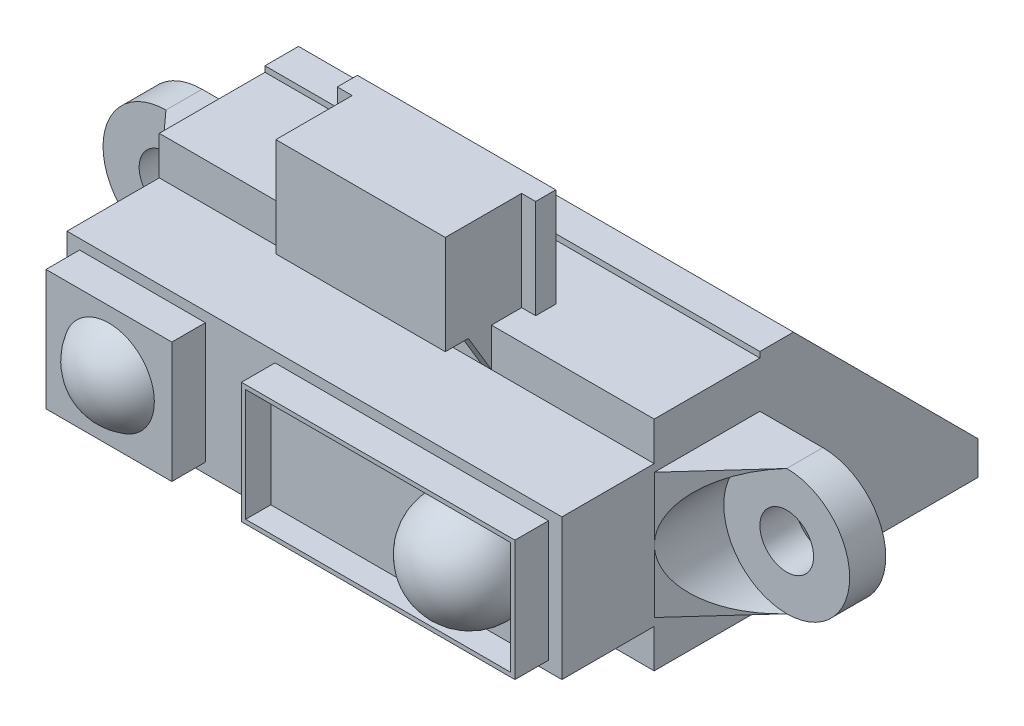
from build123d import *

# Parameters (mm, degrees)
BOSS_EXTRU_2_DEPTH      = 2.15
ESQUISSE2_W             = 14.75
ESQUISSE2_H             = 13
BOSS_EXTRU_3_DEPTH      = 6.3
BOSS_EXTRU_4_DEPTH      = 7.5
BOSS_EXTRUDE1_DEPTH     = 13
CHAMFER1_SIZE           = 11
ESQUISSE3_R             = 1.6
ENL_V_MAT_EXTRU_1_DEPTH = 6.3
ENL_V_START             = -4.15
ESQUISSE11_R            = 3.75
ENL_V_MAT_EXTRU_2_DEPTH = 4.15
ESQUISSE12_W            = 14.75
ESQUISSE12_H            = 8.4
BOSS_EXTRU_5_DEPTH      = 5.5
ESQUISSE13_W            = 16.3
ESQUISSE13_H            = 7.2
BOSS_EXTRU_6_DEPTH      = 2
ESQUISSE14_W            = 7.5
ESQUISSE14_H            = 7.2
BOSS_EXTRU_7_DEPTH      = 2
ESQUISSE16_W            = 15.8
ESQUISSE16_H            = 6.7
ENL_V_MAT_EXTRU_3_DEPTH = 1.5
BOSS_EXTRU_9_DEPTH      = 5.9
BOSS_EXTRU_10_DEPTH     = 10.1
ESQUISSE20_W            = 8.967116883
ESQUISSE20_H            = 2.3
ENL_V_MAT_EXTRU_4_DEPTH = 10.1


with BuildPart() as part:
    # Esquisse1 → Boss.-Extru.2 (new body)
    with BuildSketch(Plane.XY):
        with BuildLine():
            Line((20.065642458, -7.091397664), (16.315642458, -7.091397664))
            Line((16.315642458, -7.091397664), (16.315642458, 0.408602336))
            Line((16.315642458, 0.408602336), (20.065642458, 0.408602336))
            ThreePointArc((20.065642458, 0.408602336), (23.815642458, -3.341397664), (20.065642458, -7.091397664))
        make_face()
    extrude(amount=BOSS_EXTRU_2_DEPTH)



with BuildPart() as body_2:
    # Esquisse2 → Boss.-Extru.3 (new body)
    with BuildSketch(Plane.XY):
        with Locations((8.940642458, -3.341397664)):
            Rectangle(ESQUISSE2_W, ESQUISSE2_H)
    extrude(amount=BOSS_EXTRU_3_DEPTH)


with BuildPart() as part_1:
    add(part.part)

    add(body_2.part)  # Boss.-Extru.4 merges body 2
    # Esquisse10 → Boss.-Extru.4 (add)
    with BuildSketch(Plane.XZ.offset(7.091397664)):
        Polygon((16.315642458, 6.287787974), (20.065642458, 2.15), (16.315642458, 2.15), align=None)
    extrude(amount=-BOSS_EXTRU_4_DEPTH)

    # Esquisse1<5> → Boss-Extrude1 (add)
    with BuildSketch(Plane.XY):
        Polygon((16.315642458, 3.496275605), (1.565642458, 3.496275605), (1.565642458, -9.503724395), (16.315642458, -9.503724395), (16.315642458, -7.091397664), (16.315642458, 0.408602336), align=None)
    extrude(amount=-BOSS_EXTRUDE1_DEPTH)

    # Chamfer1
    chamfer1_edges = [part_1.edges().sort_by_distance(p)[0] for p in [
        (8.940642458, 3.496275605, -13),
    ]]
    chamfer(chamfer1_edges, length=CHAMFER1_SIZE)

    # Esquisse3 → Enlèv. mat.-Extru.1 (cut)
    with BuildSketch(Plane.XY):
        with Locations((-16.934357542, -3.341397664)):
            Circle(ESQUISSE3_R)
        with Locations((20.065642458, -3.341397664)):
            Circle(ESQUISSE3_R)
    extrude(amount=ENL_V_MAT_EXTRU_1_DEPTH, mode=Mode.SUBTRACT)

    # Esquisse11 → Enlèv. mat.-Extru.2 (cut)
    with BuildSketch(Plane.XY.offset(6.3).offset(ENL_V_START)):
        with Locations((20.065642458, -3.341397664)):
            Circle(ESQUISSE11_R)
    extrude(amount=ENL_V_MAT_EXTRU_2_DEPTH, mode=Mode.SUBTRACT)

    # Esquisse12 → Boss.-Extru.5 (add)
    with BuildSketch(Plane.XY.offset(6.3)):
        with Locations((8.940642458, -3.341397664)):
            Rectangle(ESQUISSE12_W, ESQUISSE12_H)
    extrude(amount=BOSS_EXTRU_5_DEPTH)

    # Symétrie15: part across plane


with BuildPart() as part_2:
    add(part_1.part)
    add(part_1.part.mirror(Plane(origin=(1.565642458, 3.158602336, 6.3), x_dir=(0, 0, 1), z_dir=(1, 0, 0))))

    # Esquisse13 → Boss.-Extru.6 (add)
    with BuildSketch(Plane.XY.offset(11.8)):
        with Locations((7.365642458, -3.341397664)):
            Rectangle(ESQUISSE13_W, ESQUISSE13_H)
    extrude(amount=BOSS_EXTRU_6_DEPTH)

    # Esquisse14 → Boss.-Extru.7 (add)
    with BuildSketch(Plane.XY.offset(11.8)):
        with Locations((-8.684357542, -3.341397664)):
            Rectangle(ESQUISSE14_W, ESQUISSE14_H)
    extrude(amount=BOSS_EXTRU_7_DEPTH)

    # Esquisse16 → Enlèv. mat.-Extru.3 (cut)
    with BuildSketch(Plane.XY.offset(13.8)):
        with Locations((7.365642458, -3.341397664)):
            Rectangle(ESQUISSE16_W, ESQUISSE16_H)
    extrude(amount=-ENL_V_MAT_EXTRU_3_DEPTH, mode=Mode.SUBTRACT)

    # Esquisse15 → Révolution14 (revolve)
    with BuildSketch(Plane.XY.offset(12.3)):
        with BuildLine():
            Line((14.537530361, -3.341397664), (8.093754555, -3.341397664))
            ThreePointArc((8.093754555, -3.341397664), (11.315642458, -6.563285567), (14.537530361, -3.341397664))
        make_face()
        with BuildLine():
            Line((-11.779153482, -3.341397664), (-5.589561602, -3.341397664))
            ThreePointArc((-5.589561602, -3.341397664), (-8.684357542, -6.436193604), (-11.779153482, -3.341397664))
        make_face()
    revolve(axis=Axis((-12.130427956, -3.341397664, 12.3), (1, 0, 0)))

    # Esquisse18 → Boss.-Extru.9 (add)
    with BuildSketch(Plane(origin=(0, 3.158602336, 0), x_dir=(1, 0, 0), z_dir=(0, 1, 0))):
        Polygon((6.615642458, -4.5), (6.615642458, -9.05), (-3.484357542, -9.05), (-3.484357542, -4.5), (-4.37348724, -4.5), (-4.37348724, -3.3), (7.451018627, -3.3), (7.451018627, -4.5), align=None)
    extrude(amount=BOSS_EXTRU_9_DEPTH)

    # Esquisse19 → Boss.-Extru.10 (add)
    with BuildSketch(Plane.ZY.offset(3.484357542)):
        Polygon((6.3, 0.858602336), (7.675, 3.158602336), (6.3, 3.158602336), align=None)
    extrude(amount=-BOSS_EXTRU_10_DEPTH)

    # Esquisse20 → Enlèv. mat.-Extru.4 (cut)
    with BuildSketch(Plane.XY.offset(6.3)):
        with Locations((1.525201642, 2.008602336)):
            Rectangle(ESQUISSE20_W, ESQUISSE20_H)
    extrude(amount=ENL_V_MAT_EXTRU_4_DEPTH, mode=Mode.SUBTRACT)


solid = part_2.part
